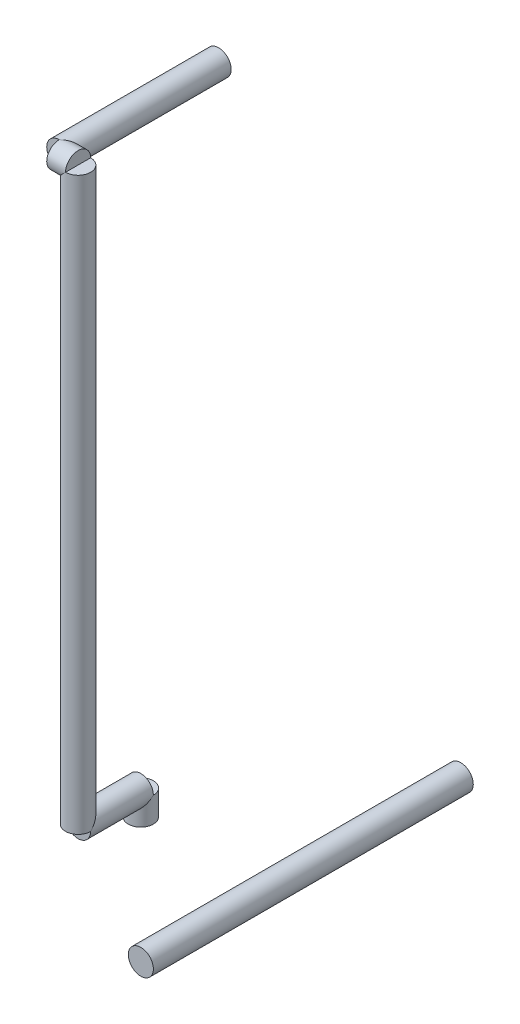
from build123d import *

# Parameters (mm, degrees)
SKETCH2_R           = 2
BOSS_EXTRUDE1_DEPTH = 51
SKETCH3_R           = 2
BOSS_EXTRUDE2_DEPTH = 4
SKETCH4_R           = 2
BOSS_EXTRUDE3_DEPTH = 10
SKETCH5_R           = 2
BOSS_EXTRUDE4_DEPTH = 91
SKETCH6_R           = 2
BOSS_EXTRUDE5_DEPTH = 3
SKETCH7_R           = 2
BOSS_EXTRUDE6_DEPTH = 25.4


with BuildPart() as part:
    # Sketch2 → Boss-Extrude1 (new body)
    with BuildSketch(Plane.XY.offset(-25)):
        with Locations((32, -94.5)):
            Circle(SKETCH2_R)
    extrude(amount=BOSS_EXTRUDE1_DEPTH)


with BuildPart() as body_2:
    # Sketch3 → Boss-Extrude2 (new body)
    with BuildSketch(Plane(origin=(0, -74.5, 0), x_dir=(1, 0, 0), z_dir=(0, 1, 0))):
        with Locations(Location((32, -26, 0), (0, 0, 270))):
            Circle(SKETCH3_R)
    extrude(amount=BOSS_EXTRUDE2_DEPTH)

    # Sketch4 → Boss-Extrude3 (add)
    with BuildSketch(Plane.XY.offset(26)):
        with Locations((32, -70.5)):
            Circle(SKETCH4_R)
    extrude(amount=BOSS_EXTRUDE3_DEPTH)

    # Sketch5 → Boss-Extrude4 (add)
    with BuildSketch(Plane(origin=(0, -70.5, 0), x_dir=(1, 0, 0), z_dir=(0, 1, 0))):
        with Locations((32, -36)):
            Circle(SKETCH5_R)
    extrude(amount=BOSS_EXTRUDE4_DEPTH)

    # Sketch6 → Boss-Extrude5 (add)
    with BuildSketch(Plane(origin=(29, 0, 0), x_dir=(0, 0, -1), z_dir=(1, 0, 0))):
        with Locations((-36, 20.5)):
            Circle(SKETCH6_R)
    extrude(amount=BOSS_EXTRUDE5_DEPTH)

    # Sketch7 → Boss-Extrude6 (add)
    with BuildSketch(Plane.XY.offset(10.6)):
        with Locations(Location((29, 20.5, 0), (0, 0, 90))):
            Circle(SKETCH7_R)
    extrude(amount=BOSS_EXTRUDE6_DEPTH)


solid = Compound([part.part, body_2.part])
